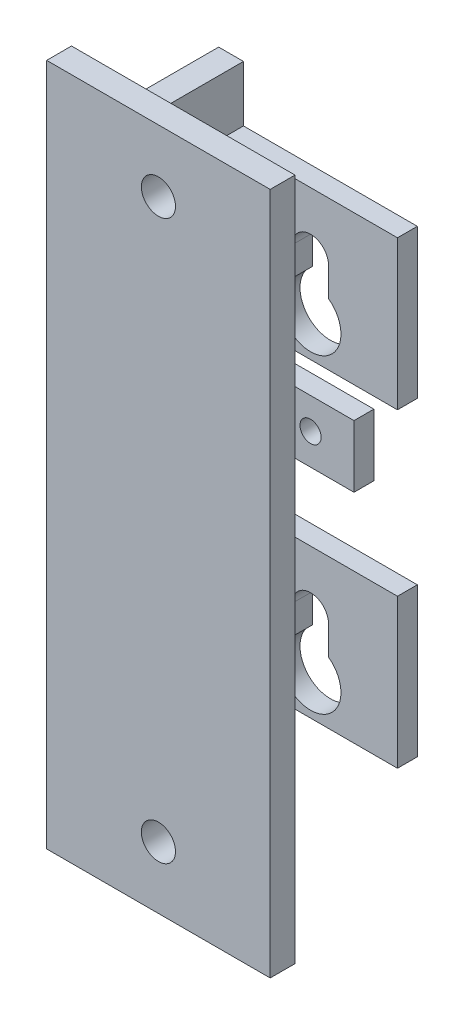
from build123d import *

# Parameters (mm, degrees)
WALL_MOUNTING_PLATE_4MM_START        = 68
SKETCH1_W                            = 36
SKETCH1_H                            = 110
WALL_MOUNTING_PLATE_4MM_DEPTH        = 4
SIDE_OFFSET_WEB_START                = 44.3
SKETCH2_W                            = 4
SKETCH2_H                            = 86
SIDE_OFFSET_WEB_DEPTH                = 24
TWO_PEG_RECEIVER_TABS_START          = 44.3
SKETCH3_W                            = 32
SKETCH3_H                            = 24
TWO_PEG_RECEIVER_TABS_DEPTH          = 3.2
PEG_HEAD_ENTRY_D9P8_START            = 43
SKETCH4_R                            = 4.9
PEG_HEAD_ENTRY_D9P8_DEPTH            = 9
DROP_IN_PEG_SLOTS_W5P8_START         = 43
SKETCH5_W                            = 5.8
SKETCH5_H                            = 8.6
DROP_IN_PEG_SLOTS_W5P8_DEPTH         = 9
ROUNDED_LOAD_SEATS_START             = 43
SKETCH6_R                            = 2.9
ROUNDED_LOAD_SEATS_DEPTH             = 9
WALL_SCREW_CLEARANCE_D5P5_START      = 67
SKETCH7_R                            = 2.75
WALL_SCREW_CLEARANCE_D5P5_DEPTH      = 7
ANTI_LIFT_LOCK_TAB_START             = 44.3
SKETCH8_W                            = 25
SKETCH8_H                            = 10
ANTI_LIFT_LOCK_TAB_DEPTH             = 3.2
ANTI_LIFT_SCREW_CLEARANCE_D3P4_START = 43
SKETCH9_R                            = 1.7
ANTI_LIFT_SCREW_CLEARANCE_D3P4_DEPTH = 7


with BuildPart() as part:
    # Sketch1 → Wall_mounting_plate_4mm (new body)
    with BuildSketch(Plane.XY.offset(WALL_MOUNTING_PLATE_4MM_START)):
        with Locations((-20, 0)):
            Rectangle(SKETCH1_W, SKETCH1_H)
    extrude(amount=WALL_MOUNTING_PLATE_4MM_DEPTH)

    # Sketch2 → Side_offset_web (add)
    with BuildSketch(Plane.XY.offset(SIDE_OFFSET_WEB_START)):
        with Locations((-36, 0)):
            Rectangle(SKETCH2_W, SKETCH2_H)
    extrude(amount=SIDE_OFFSET_WEB_DEPTH)

    # Sketch3 → Two_peg_receiver_tabs (add)
    with BuildSketch(Plane.XY.offset(TWO_PEG_RECEIVER_TABS_START)):
        with Locations((-22, -28)):
            Rectangle(SKETCH3_W, SKETCH3_H)
        with Locations((-22, 22)):
            Rectangle(SKETCH3_W, SKETCH3_H)
    extrude(amount=TWO_PEG_RECEIVER_TABS_DEPTH)

    # Sketch4 → Peg_head_entry_D9p8 (cut)
    with BuildSketch(Plane.XY.offset(PEG_HEAD_ENTRY_D9P8_START)):
        with Locations((-20, -34)):
            Circle(SKETCH4_R)
        with Locations((-20, 16)):
            Circle(SKETCH4_R)
    extrude(amount=PEG_HEAD_ENTRY_D9P8_DEPTH, mode=Mode.SUBTRACT)

    # Sketch5 → Drop_in_peg_slots_W5p8 (cut)
    with BuildSketch(Plane.XY.offset(DROP_IN_PEG_SLOTS_W5P8_START)):
        with Locations((-20, -29.7)):
            Rectangle(SKETCH5_W, SKETCH5_H)
        with Locations((-20, 20.3)):
            Rectangle(SKETCH5_W, SKETCH5_H)
    extrude(amount=DROP_IN_PEG_SLOTS_W5P8_DEPTH, mode=Mode.SUBTRACT)

    # Sketch6 → Rounded_load_seats (cut)
    with BuildSketch(Plane.XY.offset(ROUNDED_LOAD_SEATS_START)):
        with Locations((-20, -25.4)):
            Circle(SKETCH6_R)
        with Locations((-20, 24.6)):
            Circle(SKETCH6_R)
    extrude(amount=ROUNDED_LOAD_SEATS_DEPTH, mode=Mode.SUBTRACT)

    # Sketch7 → Wall_screw_clearance_D5p5 (cut)
    with BuildSketch(Plane.XY.offset(WALL_SCREW_CLEARANCE_D5P5_START)):
        with Locations((-20, -45)):
            Circle(SKETCH7_R)
        with Locations((-20, 45)):
            Circle(SKETCH7_R)
    extrude(amount=WALL_SCREW_CLEARANCE_D5P5_DEPTH, mode=Mode.SUBTRACT)

    # Sketch8 → Anti_lift_lock_tab (add)
    with BuildSketch(Plane.XY.offset(ANTI_LIFT_LOCK_TAB_START)):
        with Locations((-25.5, 0)):
            Rectangle(SKETCH8_W, SKETCH8_H)
    extrude(amount=ANTI_LIFT_LOCK_TAB_DEPTH)

    # Sketch9 → Anti_lift_screw_clearance_D3p4 (cut)
    with BuildSketch(Plane.XY.offset(ANTI_LIFT_SCREW_CLEARANCE_D3P4_START)):
        with Locations((-20, 0)):
            Circle(SKETCH9_R)
    extrude(amount=ANTI_LIFT_SCREW_CLEARANCE_D3P4_DEPTH, mode=Mode.SUBTRACT)


solid = part.part
